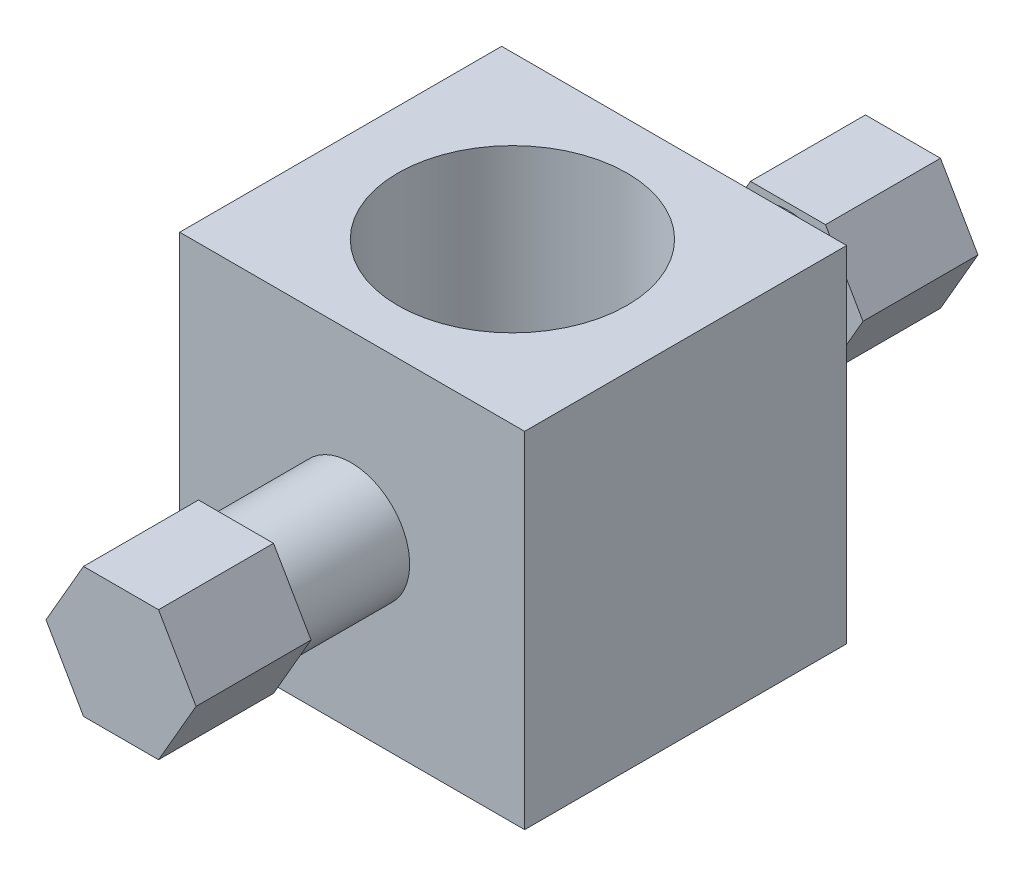
from build123d import *

# Parameters (mm, degrees)
SKETCH1_R                = 2.55
BOSS_EXTRUDE1_DEPTH      = 24
BOSS_EXTRUDE2_DEPTH      = 5
BOSS_EXTRUDE3_DEPTH      = 5
BOSS_EXTRUDE5_DEPTH      = 7.5
BOSS_EXTRUDE5_DEPTH_BACK = 7.5
SKETCH4_W                = 15
SKETCH4_H                = 14
SKETCH9_R                = 4.986373578
CUT_EXTRUDE2_DEPTH       = 16.5


with BuildPart() as part:
    # Sketch1 → Boss-Extrude1 (new body)
    with BuildSketch(Plane.XY):
        Circle(SKETCH1_R)
    extrude(amount=BOSS_EXTRUDE1_DEPTH)

    # Sketch2 → Boss-Extrude2 (add)
    with BuildSketch(Plane.XY.offset(24)):
        Polygon((3.262188456, 0), (1.631094228, 2.825138074), (-1.631094228, 2.825138074), (-3.262188456, 0), (-1.631094228, -2.825138074), (1.631094228, -2.825138074), align=None)
    extrude(amount=BOSS_EXTRUDE2_DEPTH)

    # Sketch3 → Boss-Extrude3 (add)
    with BuildSketch(Plane(origin=(0, 0, 0), x_dir=(-1, 0, 0), z_dir=(0, 0, -1))):
        Polygon((3.262188456, 0), (1.631094228, 2.825138074), (-1.631094228, 2.825138074), (-3.262188456, 0), (-1.631094228, -2.825138074), (1.631094228, -2.825138074), align=None)
    extrude(amount=BOSS_EXTRUDE3_DEPTH)

    # Sketch4 → Boss-Extrude5 (add, two sides: drawn at the far end of the back side and taken through both)
    with BuildSketch(Plane(origin=(0, 0, 0), x_dir=(1, 0, 0), z_dir=(0, 1, 0)).offset(-BOSS_EXTRUDE5_DEPTH_BACK)):
        with Locations((0.05, -12)):
            Rectangle(SKETCH4_W, SKETCH4_H)
    extrude(amount=BOSS_EXTRUDE5_DEPTH + BOSS_EXTRUDE5_DEPTH_BACK)

    # Sketch9 → Cut-Extrude2 (cut)
    with BuildSketch(Plane(origin=(0, 7.5, 0), x_dir=(1, 0, 0), z_dir=(0, 1, 0))):
        with Locations(Location((0.05, -12.031387259, 0), (0, 0, 270))):
            Circle(SKETCH9_R)
    extrude(amount=-CUT_EXTRUDE2_DEPTH, mode=Mode.SUBTRACT)


solid = part.part
